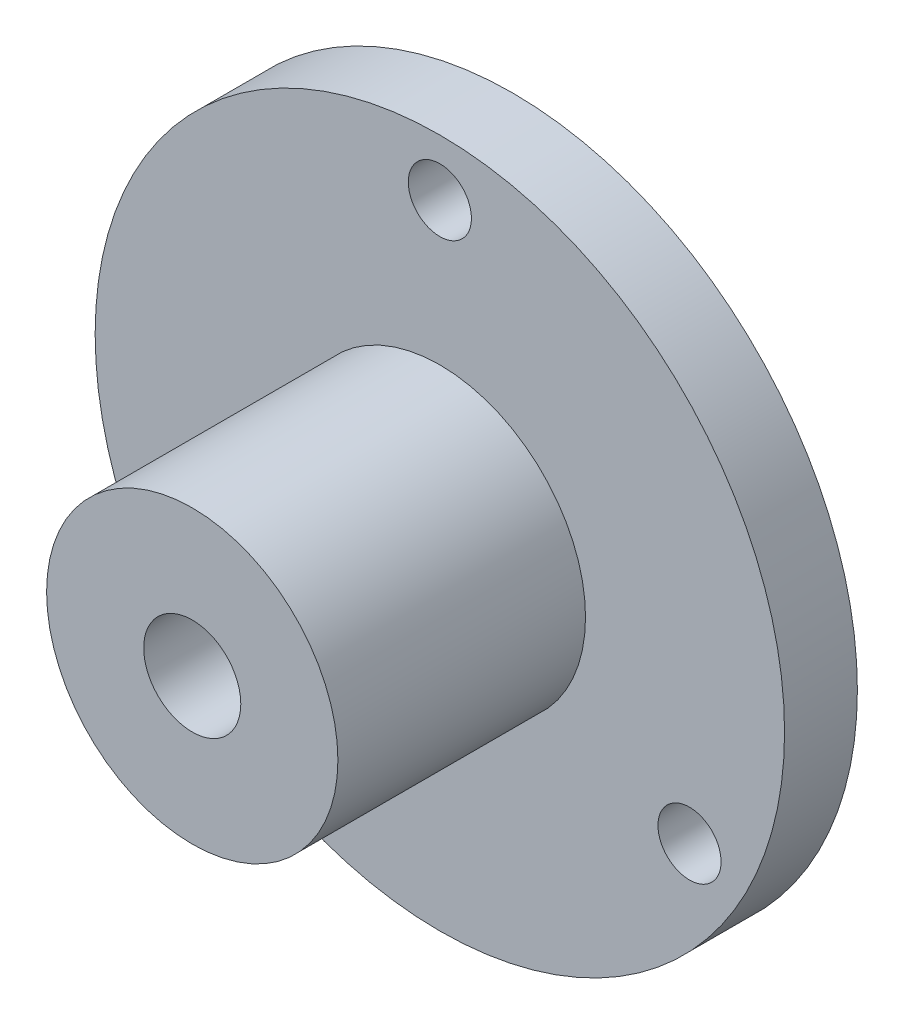
from build123d import *

# Parameters (mm, degrees)
SKETCH2_R           = 28.4
BOSS_EXTRUDE1_DEPTH = 6
SKETCH3_R           = 12
BOSS_EXTRUDE2_DEPTH = 20.4
SKETCH4_R           = 4
CUT_EXTRUDE1_DEPTH  = 49.063291606
SKETCH5_R           = 2.6
CUT_EXTRUDE2_DEPTH  = 49.063291606
CIRPATTERN2_COUNT   = 3
SKETCH6_R           = 2.5
CUT_EXTRUDE3_DEPTH  = 49.063291606


with BuildPart() as part:
    # Sketch2 → Boss-Extrude1 (new body)
    with BuildSketch(Plane.XY):
        Circle(SKETCH2_R)
    extrude(amount=BOSS_EXTRUDE1_DEPTH)

    # Sketch3 → Boss-Extrude2 (add)
    with BuildSketch(Plane.XY.offset(6)):
        Circle(SKETCH3_R)
    extrude(amount=BOSS_EXTRUDE2_DEPTH)

    # Sketch4 → Cut-Extrude1 (cut, through all)
    with BuildSketch(Plane.XY.offset(26.4)):
        Circle(SKETCH4_R)
    extrude(amount=-CUT_EXTRUDE1_DEPTH, mode=Mode.SUBTRACT)

    # Sketch5 → Cut-Extrude2 (cut, through all)
    with BuildSketch(Plane(origin=(0, 0, 0), x_dir=(-1, 0, 0), z_dir=(0, 0, -1))):
        with Locations((0, 23.75)):
            Circle(SKETCH5_R)
    cut_extrude2 = extrude(amount=-CUT_EXTRUDE2_DEPTH, mode=Mode.SUBTRACT)

    # CirPattern2: Cut-Extrude2 ×3 about axis
    cirpattern2_axis = Axis((0, 0, 0), (0, 0, 1))
    for i in range(1, CIRPATTERN2_COUNT):
        add(cut_extrude2.rotate(cirpattern2_axis, i * 360 / CIRPATTERN2_COUNT), mode=Mode.SUBTRACT)

    # Sketch6 → Cut-Extrude3 (cut, through all)
    with BuildSketch(Plane(origin=(0, 0, 0), x_dir=(0, 0, -1), z_dir=(1, 0, 0))):
        with Locations((-16.2, 0)):
            Circle(SKETCH6_R)
    extrude(amount=-CUT_EXTRUDE3_DEPTH, mode=Mode.SUBTRACT)


solid = part.part
